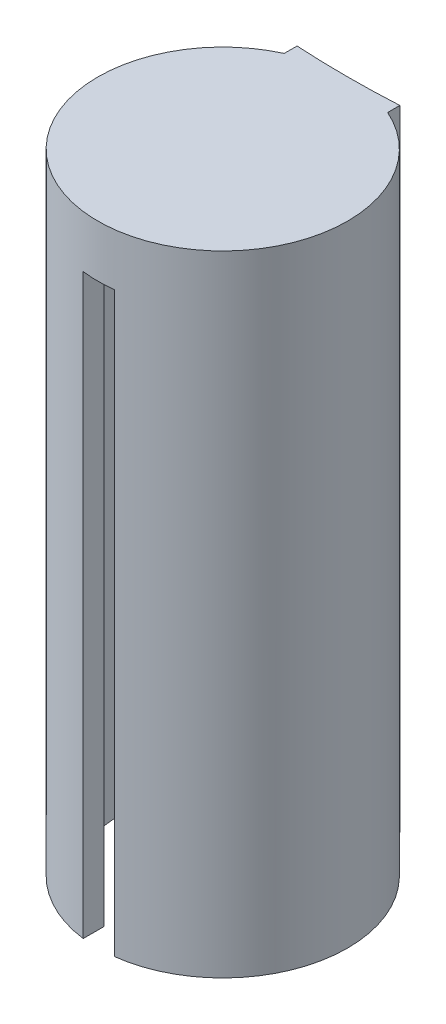
from build123d import *

# Parameters (mm, degrees)
BOSS_EXTRUDE1_DEPTH = 1110
SKETCH2_R           = 240
BOSS_EXTRUDE2_DEPTH = 100
BOSS_EXTRUDE3_DEPTH = 1210


with BuildPart() as part:
    # Sketch1 → Boss-Extrude1 (new body)
    with BuildSketch(Plane(origin=(0, 0, 0), x_dir=(1, 0, 0), z_dir=(0, 1, 0))):
        with BuildLine():
            Line((-30, -197.737199333), (-30, -238.117617996))
            ThreePointArc((-30, -238.117617996), (0, 240), (30, -238.117617996))
            Line((30, -238.117617996), (30, -197.737199333))
            ThreePointArc((30, -197.737199333), (200, 0), (30, 197.737199333))
            Line((30, 197.737199333), (30, 220))
            Line((30, 220), (-30, 220))
            Line((-30, 220), (-30, 197.737199333))
            ThreePointArc((-30, 197.737199333), (-200, 0), (-30, -197.737199333))
        make_face()
    extrude(amount=BOSS_EXTRUDE1_DEPTH)

    # Sketch2 → Boss-Extrude2 (add)
    with BuildSketch(Plane(origin=(0, 1110, 0), x_dir=(1, 0, 0), z_dir=(0, 1, 0))):
        with Locations(Location((0, 0, 0), (0, 0, 262.819244219))):
            Circle(SKETCH2_R)
    extrude(amount=BOSS_EXTRUDE2_DEPTH)

    # Sketch3 → Boss-Extrude3 (add, through all)
    with BuildSketch(Plane(origin=(0, 1210, 0), x_dir=(1, 0, 0), z_dir=(0, 1, 0))):
        with BuildLine():
            Line((-100, 242.859479034), (-100, 240))
            Line((-100, 240), (-100, 218.174242293))
            ThreePointArc((-100, 218.174242293), (-51.177054673, 234.48008247), (-3e-09, 240))
            ThreePointArc((-3e-09, 240), (-50.020437376, 240.715015829), (-100, 242.859479034))
        make_face()
        with BuildLine():
            ThreePointArc((97.679334818, 242.72819872), (48.858713445, 240.682182644), (-3e-09, 240))
            ThreePointArc((-3e-09, 240), (49.932288955, 234.748304615), (97.679334818, 219.223054329))
            Line((97.679334818, 219.223054329), (97.679334818, 242.72819872))
        make_face()
    extrude(amount=-BOSS_EXTRUDE3_DEPTH)


solid = part.part
